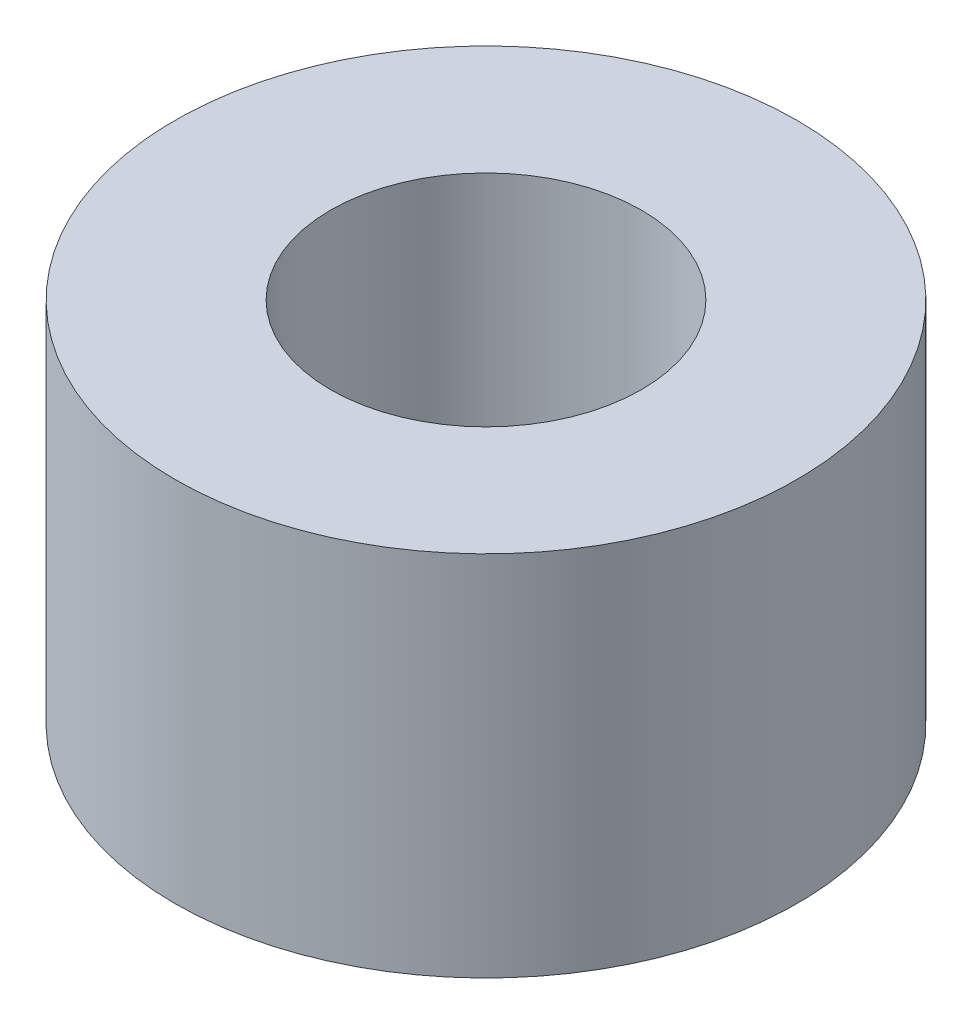
from build123d import *

# Parameters (mm, degrees)
SKETCH1_R           = 12.7
SKETCH1_R_2         = 6.35
BOSS_EXTRUDE1_DEPTH = 15


with BuildPart() as part:
    # Sketch1 → Boss-Extrude1 (new body)
    with BuildSketch(Plane(origin=(0, 0, 0), x_dir=(1, 0, 0), z_dir=(0, 1, 0))):
        with Locations(Location((0, 0, 0), (0, 0, 270))):
            Circle(SKETCH1_R)
        with Locations(Location((0, 0, 0), (0, 0, 270))):
            Circle(SKETCH1_R_2, mode=Mode.SUBTRACT)
    extrude(amount=BOSS_EXTRUDE1_DEPTH)


solid = part.part
